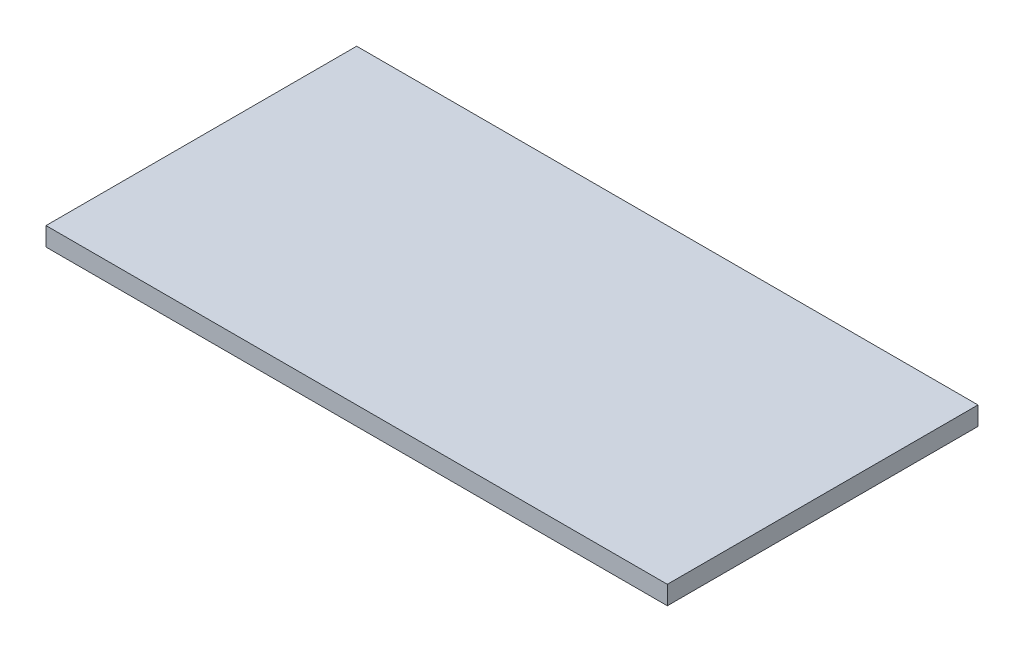
from build123d import *

# Parameters (mm, degrees)
SKETCH_1_W      = 100
SKETCH_1_H      = 50
EXTRUDE_1_DEPTH = 3


with BuildPart() as part:
    # 草图1 → 凸台-拉伸1 (new body)
    with BuildSketch(Plane(origin=(0, 0, 0), x_dir=(1, 0, 0), z_dir=(0, 1, 0))):
        Rectangle(SKETCH_1_W, SKETCH_1_H)
    extrude(amount=EXTRUDE_1_DEPTH)


solid = part.part
